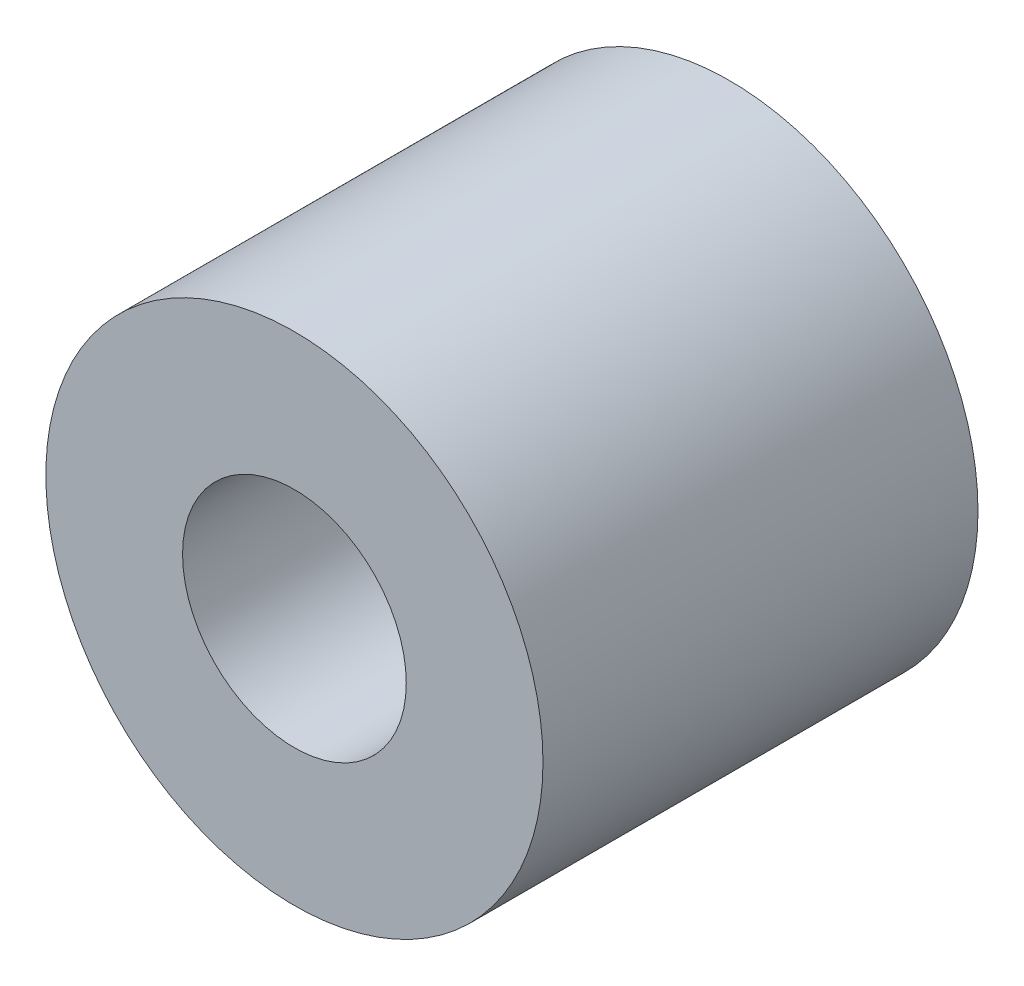
from build123d import *

# Parameters (mm, degrees)
SKETCH1_R           = 2
SKETCH1_R_2         = 0.9
BOSS_EXTRUDE1_DEPTH = 3.5


with BuildPart() as part:
    # Sketch1 → Boss-Extrude1 (new body)
    with BuildSketch(Plane(origin=(0, 0, 0), x_dir=(0, 1, 0), z_dir=(0, 0, 1))):
        with Locations(Location((0, 0, 0), (0, 0, 270))):
            Circle(SKETCH1_R)
        with Locations(Location((0, 0, 0), (0, 0, 270))):
            Circle(SKETCH1_R_2, mode=Mode.SUBTRACT)
    extrude(amount=BOSS_EXTRUDE1_DEPTH)


solid = part.part
